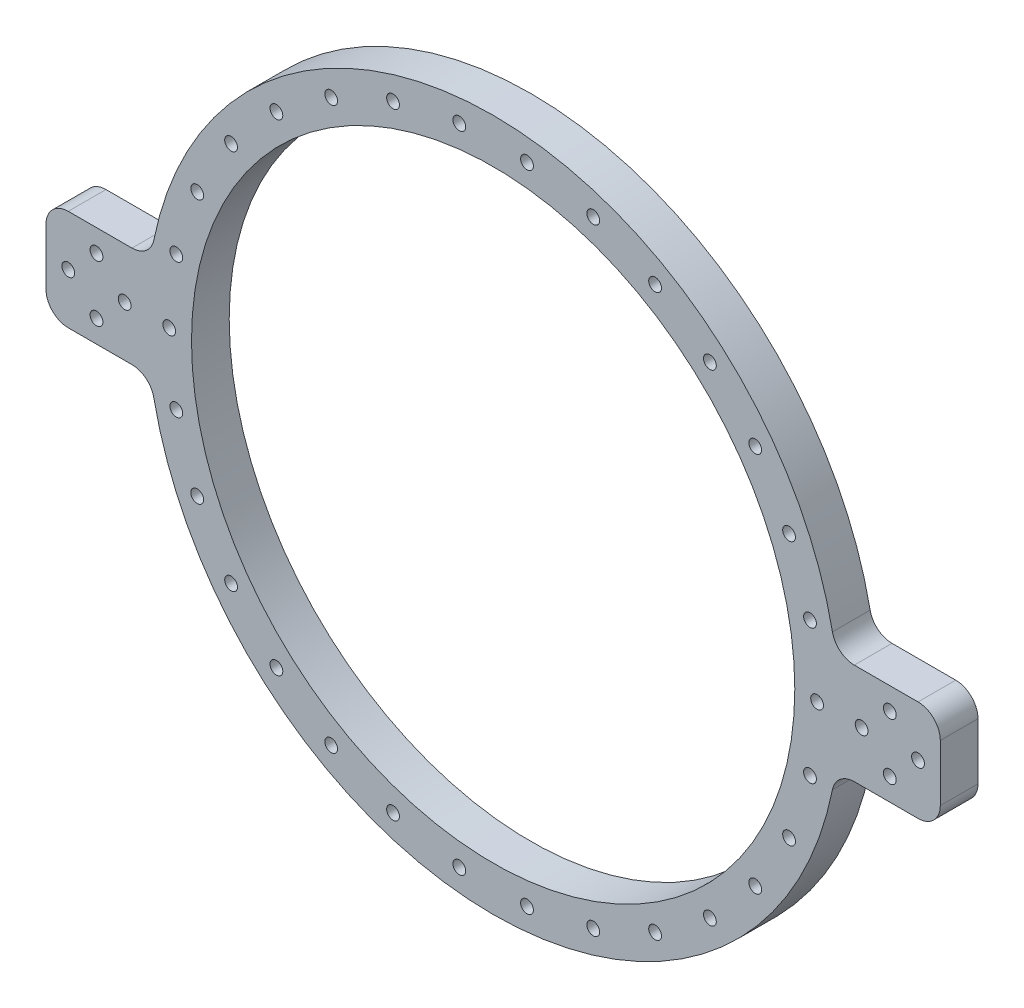
from build123d import *

# Parameters (mm, degrees)
SKETCH1_R           = 101.6
SKETCH1_R_2         = 2.1525
BOSS_EXTRUDE1_DEPTH = 12.7
FILLET1_R           = 7.5


with BuildPart() as part:
    # Sketch1 → Boss-Extrude1 (new body)
    with BuildSketch(Plane.XY):
        with BuildLine():
            Line((115.326459663, 17), (143.1, 17))
            ThreePointArc((143.1, 17), (148.403300859, 14.803300859), (150.6, 9.5))
            Line((150.6, 9.5), (150.6, -9.5))
            ThreePointArc((150.6, -9.5), (148.403300859, -14.803300859), (143.1, -17))
            Line((143.1, -17), (115.326459663, -17))
            ThreePointArc((115.326459663, -17), (0, -116.572691049), (-115.326459663, -17))
            Line((-115.326459663, -17), (-143.1, -17))
            ThreePointArc((-143.1, -17), (-148.403300859, -14.803300859), (-150.6, -9.5))
            Line((-150.6, -9.5), (-150.6, 9.5))
            ThreePointArc((-150.6, 9.5), (-148.403300859, 14.803300859), (-143.1, 17))
            Line((-143.1, 17), (-115.326459663, 17))
            ThreePointArc((-115.326459663, 17), (0, 116.572691049), (115.326459663, 17))
        make_face()
        Circle(SKETCH1_R, mode=Mode.SUBTRACT)
        with Locations((109.1, 0)):
            Circle(SKETCH1_R_2, mode=Mode.SUBTRACT)
        with Locations((106.71590324, -22.683165468)):
            Circle(SKETCH1_R_2, mode=Mode.SUBTRACT)
        with Locations((99.667809429, -44.37496776)):
            Circle(SKETCH1_R_2, mode=Mode.SUBTRACT)
        with Locations((88.263754086, -64.127371025)):
            Circle(SKETCH1_R_2, mode=Mode.SUBTRACT)
        with Locations((73.002149154, -81.07710046)):
            Circle(SKETCH1_R_2, mode=Mode.SUBTRACT)
        with Locations((54.55, -94.483371553)):
            Circle(SKETCH1_R_2, mode=Mode.SUBTRACT)
        with Locations((33.713754086, -103.760265928)):
            Circle(SKETCH1_R_2, mode=Mode.SUBTRACT)
        with Locations((11.404055343, -108.502338785)):
            Circle(SKETCH1_R_2, mode=Mode.SUBTRACT)
        with Locations((-11.404055343, -108.502338785)):
            Circle(SKETCH1_R_2, mode=Mode.SUBTRACT)
        with Locations((-33.713754086, -103.760265928)):
            Circle(SKETCH1_R_2, mode=Mode.SUBTRACT)
        with Locations((-54.55, -94.483371553)):
            Circle(SKETCH1_R_2, mode=Mode.SUBTRACT)
        with Locations((-73.002149154, -81.07710046)):
            Circle(SKETCH1_R_2, mode=Mode.SUBTRACT)
        with Locations((-88.263754086, -64.127371025)):
            Circle(SKETCH1_R_2, mode=Mode.SUBTRACT)
        with Locations((-99.667809429, -44.37496776)):
            Circle(SKETCH1_R_2, mode=Mode.SUBTRACT)
        with Locations((-106.71590324, -22.683165468)):
            Circle(SKETCH1_R_2, mode=Mode.SUBTRACT)
        with Locations((-109.1, 0)):
            Circle(SKETCH1_R_2, mode=Mode.SUBTRACT)
        with Locations((-106.71590324, 22.683165468)):
            Circle(SKETCH1_R_2, mode=Mode.SUBTRACT)
        with Locations((-99.667809429, 44.37496776)):
            Circle(SKETCH1_R_2, mode=Mode.SUBTRACT)
        with Locations((-88.263754086, 64.127371025)):
            Circle(SKETCH1_R_2, mode=Mode.SUBTRACT)
        with Locations((-73.002149154, 81.07710046)):
            Circle(SKETCH1_R_2, mode=Mode.SUBTRACT)
        with Locations((-54.55, 94.483371553)):
            Circle(SKETCH1_R_2, mode=Mode.SUBTRACT)
        with Locations((-33.713754086, 103.760265928)):
            Circle(SKETCH1_R_2, mode=Mode.SUBTRACT)
        with Locations((-11.404055343, 108.502338785)):
            Circle(SKETCH1_R_2, mode=Mode.SUBTRACT)
        with Locations((11.404055343, 108.502338785)):
            Circle(SKETCH1_R_2, mode=Mode.SUBTRACT)
        with Locations((33.713754086, 103.760265928)):
            Circle(SKETCH1_R_2, mode=Mode.SUBTRACT)
        with Locations((54.55, 94.483371553)):
            Circle(SKETCH1_R_2, mode=Mode.SUBTRACT)
        with Locations((73.002149154, 81.07710046)):
            Circle(SKETCH1_R_2, mode=Mode.SUBTRACT)
        with Locations((88.263754086, 64.127371025)):
            Circle(SKETCH1_R_2, mode=Mode.SUBTRACT)
        with Locations((99.667809429, 44.37496776)):
            Circle(SKETCH1_R_2, mode=Mode.SUBTRACT)
        with Locations((106.71590324, 22.683165468)):
            Circle(SKETCH1_R_2, mode=Mode.SUBTRACT)
        with Locations((133.6, 9.5)):
            Circle(SKETCH1_R_2, mode=Mode.SUBTRACT)
        with Locations((133.6, -9.5)):
            Circle(SKETCH1_R_2, mode=Mode.SUBTRACT)
        with Locations((143.1, 0)):
            Circle(SKETCH1_R_2, mode=Mode.SUBTRACT)
        with Locations((124.1, 0)):
            Circle(SKETCH1_R_2, mode=Mode.SUBTRACT)
        with Locations(Location((-143.1, 0, 0), (0, 0, 180))):
            Circle(SKETCH1_R_2, mode=Mode.SUBTRACT)
        with Locations(Location((-133.6, -9.5, 0), (0, 0, 180))):
            Circle(SKETCH1_R_2, mode=Mode.SUBTRACT)
        with Locations(Location((-124.1, 0, 0), (0, 0, 180))):
            Circle(SKETCH1_R_2, mode=Mode.SUBTRACT)
        with Locations(Location((-133.6, 9.5, 0), (0, 0, 180))):
            Circle(SKETCH1_R_2, mode=Mode.SUBTRACT)
    extrude(amount=BOSS_EXTRUDE1_DEPTH)

    # Fillet1
    fillet1_edges = [part.edges().sort_by_distance(p)[0] for p in [
        (115.326459663, 17, 6.35),
        (115.326459663, -17, 6.35),
        (-115.326459663, -17, 6.35),
        (-115.326459663, 17, 6.35),
    ]]
    fillet(fillet1_edges, radius=FILLET1_R)


solid = part.part
